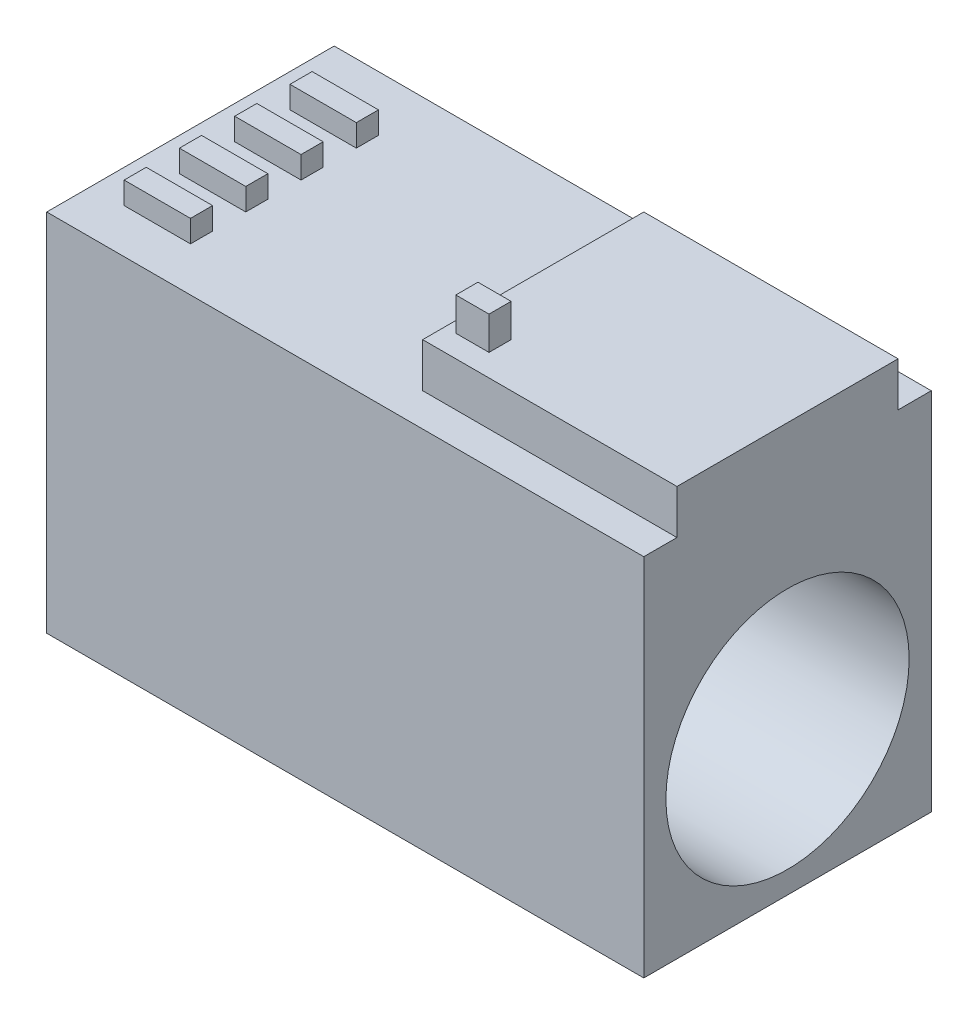
from build123d import *

# Parameters (mm, degrees)
DODANIE_WYCI_GNI_CIE1_DEPTH = 130
SZKIC2_W                    = 115
SZKIC2_H                    = 15
WYTNIJ_WYCI_GNI_CIE1_DEPTH  = 20
SZKIC3_W                    = 30
SZKIC3_H                    = 10
DODANIE_WYCI_GNI_CIE2_DEPTH = 10
SZKIC4_W                    = 15
SZKIC4_H                    = 10
DODANIE_WYCI_GNI_CIE3_DEPTH = 15
SZKIC5_R                    = 55
WYTNIJ_WYCI_GNI_CIE2_DEPTH  = 361.277670693


with BuildPart() as part:
    # Szkic1 → Dodanie-wyciągnięcie1 (new body)
    with BuildSketch(Plane.XY):
        Polygon((135, 0), (-135, 0), (-135, 165), (20, 165), (20, 185), (135, 185), align=None)
    extrude(amount=DODANIE_WYCI_GNI_CIE1_DEPTH)

    # Szkic2 → Wytnij-wyciągnięcie1 (cut)
    with BuildSketch(Plane(origin=(0, 185, 0), x_dir=(1, 0, 0), z_dir=(0, 1, 0))):
        with Locations((77.5, -122.5)):
            Rectangle(SZKIC2_W, SZKIC2_H)
        with Locations((77.5, -7.5)):
            Rectangle(SZKIC2_W, SZKIC2_H)
    extrude(amount=-WYTNIJ_WYCI_GNI_CIE1_DEPTH, mode=Mode.SUBTRACT)

    # Szkic3 → Dodanie-wyciągnięcie2 (add)
    with BuildSketch(Plane(origin=(0, 165, 0), x_dir=(1, 0, 0), z_dir=(0, 1, 0))):
        with Locations((-105, -105)):
            Rectangle(SZKIC3_W, SZKIC3_H)
        with Locations((-105, -80)):
            Rectangle(SZKIC3_W, SZKIC3_H)
        with Locations((-105, -55)):
            Rectangle(SZKIC3_W, SZKIC3_H)
        with Locations((-105, -30)):
            Rectangle(SZKIC3_W, SZKIC3_H)
    extrude(amount=DODANIE_WYCI_GNI_CIE2_DEPTH)

    # Szkic4 → Dodanie-wyciągnięcie3 (add)
    with BuildSketch(Plane(origin=(0, 185, 0), x_dir=(1, 0, 0), z_dir=(0, 1, 0))):
        with Locations((32.5, -100)):
            Rectangle(SZKIC4_W, SZKIC4_H)
    extrude(amount=DODANIE_WYCI_GNI_CIE3_DEPTH)

    # Szkic5 → Wytnij-wyciągnięcie2 (cut, through all)
    with BuildSketch(Plane.ZY.offset(135)):
        with Locations((65, 65)):
            Circle(SZKIC5_R)
    extrude(amount=-WYTNIJ_WYCI_GNI_CIE2_DEPTH, mode=Mode.SUBTRACT)


solid = part.part
